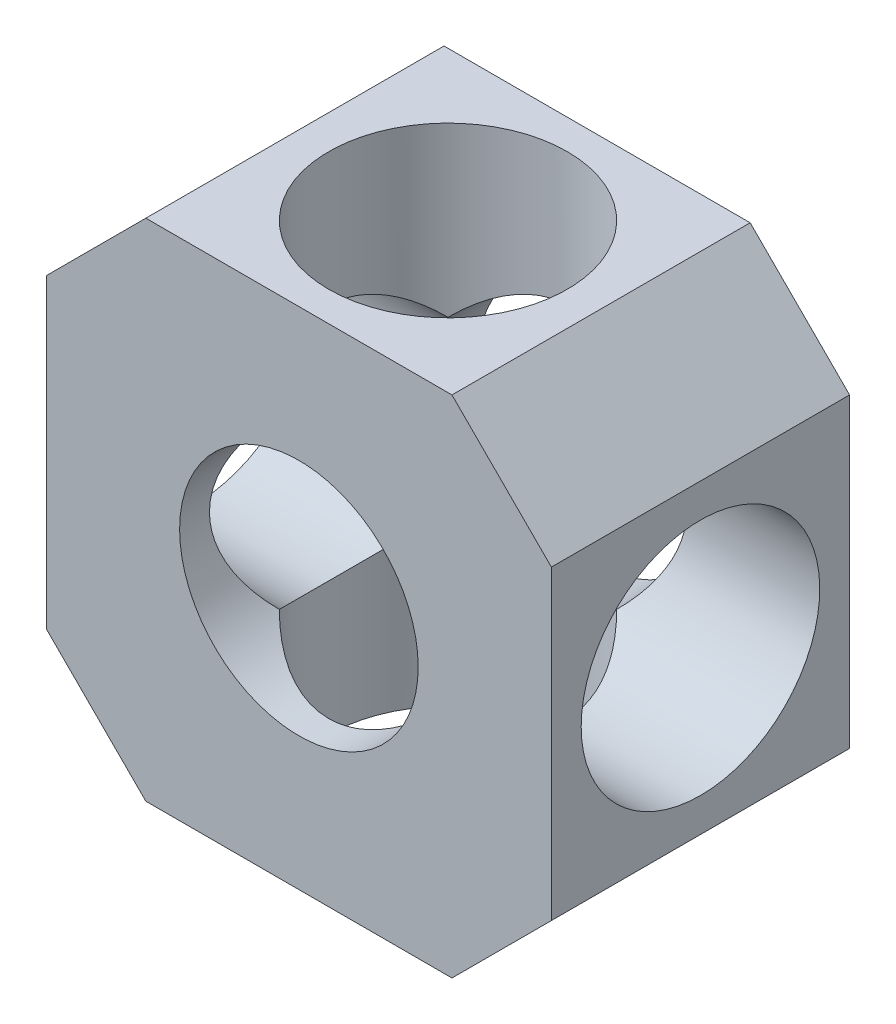
from build123d import *

# Parameters (mm, degrees)
IZIM2_W                     = 25.4
IZIM2_H                     = 25.4
Y_KSEKLIK_EKSTR_ZYON1_DEPTH = 7.5
PAH1_SIZE                   = 5
IZIM3_R                     = 6
KES_EKSTR_ZYON1_DEPTH       = 15
IZIM4_R                     = 6
KES_EKSTR_ZYON3_DEPTH       = 28
DAIRESEL_KAPLAMA1_COUNT     = 4


with BuildPart() as part:
    # Çizim2 → Yükseklik-Ekstrüzyon1 (new, symmetric)
    with BuildSketch(Plane.XY):
        Rectangle(IZIM2_W, IZIM2_H)
    extrude(amount=Y_KSEKLIK_EKSTR_ZYON1_DEPTH, both=True)

    # Pah1
    pah1_edges = [part.edges().sort_by_distance(p)[0] for p in [
        (12.7, -12.7, 0),
        (-12.7, -12.7, 0),
        (-12.7, 12.7, 0),
        (12.7, 12.7, 0),
    ]]
    chamfer(pah1_edges, length=PAH1_SIZE)

    # Çizim3 → Kes-Ekstrüzyon1 (cut)
    with BuildSketch(Plane(origin=(0, 0, -7.5), x_dir=(-1, 0, 0), z_dir=(0, 0, -1))):
        Circle(IZIM3_R)
    extrude(amount=-KES_EKSTR_ZYON1_DEPTH, mode=Mode.SUBTRACT)

    # Çizim4 → Kes-Ekstrüzyon3 (cut)
    with BuildSketch(Plane(origin=(0, 12.7, 0), x_dir=(1, 0, 0), z_dir=(0, 1, 0))):
        with Locations(Location((0, 0, 0), (0, 0, 270))):
            Circle(IZIM4_R)
    kes_ekstr_zyon3 = extrude(amount=-KES_EKSTR_ZYON3_DEPTH, mode=Mode.SUBTRACT)

    # Dairesel Kaplama1: Kes-Ekstrüzyon3 ×4 about axis
    dairesel_kaplama1_axis = Axis((0, 0, 7.5), (0, 0, -1))
    for i in range(1, DAIRESEL_KAPLAMA1_COUNT):
        add(kes_ekstr_zyon3.rotate(dairesel_kaplama1_axis, i * 360 / DAIRESEL_KAPLAMA1_COUNT), mode=Mode.SUBTRACT)


solid = part.part
